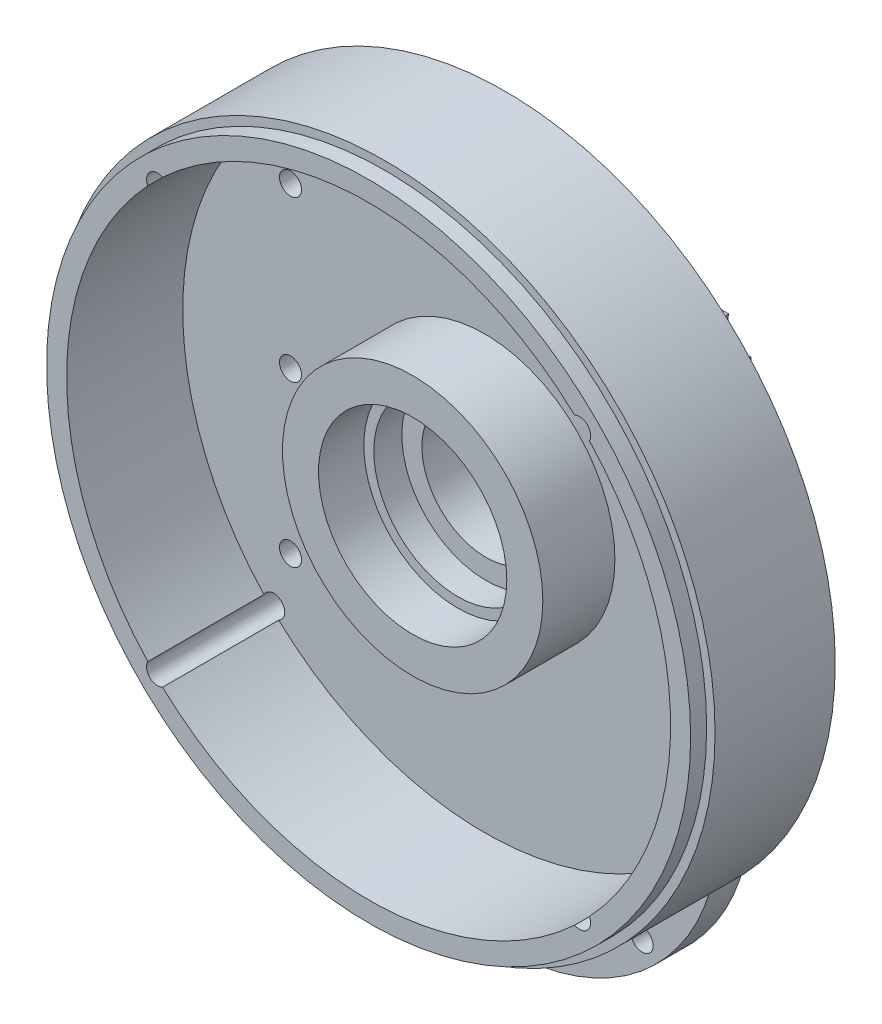
from build123d import *

# Parameters (mm, degrees)
EXTRUS_O1_DEPTH                        = 8
ESBO_O2_R                              = 82.5
EXTRUS_O2_DEPTH                        = 34
ESBO_O3_OUTSIDE_W                      = 217.358
ESBO_O3_OUTSIDE_H                      = 237.858
ESBO_O3_OUTSIDE_R                      = 80.4
CORTE_EXTRUS_O1_DEPTH                  = 4
ESBO_O4_R                              = 75.4
CORTE_EXTRUS_O2_DEPTH                  = 29
ESBO_O5_R                              = 32.5
EXTRUS_O3_DEPTH                        = 18
ESBO_O6_R                              = 23.5
CORTE_EXTRUS_O3_DEPTH                  = 11.3
ESBO_O7_R                              = 21
CORTE_EXTRUS_O4_DEPTH                  = 7
ESBO_O8_R                              = 16
CORTE_EXTRUS_O5_DEPTH                  = 136.752725571
ESBO_O9_R                              = 22.5
EXTRUS_O4_DEPTH                        = 1
ESBO_O10_R                             = 16
CORTE_EXTRUS_O7_DEPTH                  = 9
ESBO_O11_R                             = 13
CORTE_EXTRUS_O8_DEPTH                  = 2
FURO_DE_DI_METRO_5_5_5_5_1_D           = 5.5
FURO_DE_DI_METRO_5_5_5_5_1_CSINK_D     = 6
FURO_DE_DI_METRO_5_5_5_5_1_CSINK_ANGLE = 118
ESBO_O12_R                             = 5
CORTE_EXTRUS_O9_DEPTH                  = 8
FURO_DE_DI_METRO_5_5_5_5_2_D           = 5.5
CIRPATTERN1_COUNT                      = 4
CORTE_EXTRUS_O10_START                 = -2
ESBO_O18_R                             = 22.5
CORTE_EXTRUS_O10_DEPTH                 = 2
FURO_DE_DI_METRO_5_0_5_1_D             = 5
FURO_DE_DI_METRO_5_5_5_5_3_D           = 5.5
FURO_DE_DI_METRO_5_5_5_5_3_DEPTH       = 11
FURO_DE_DI_METRO_5_5_5_5_3_TIP         = 1.652366702


with BuildPart() as part:
    # Esboço1 → Extrusão1 (new body)
    with BuildSketch(Plane.XY):
        with BuildLine():
            Line((-53.5, 53.5), (-53.5, -50.25))
            ThreePointArc((-53.5, -50.25), (0, -103.75), (53.5, -50.25))
            Line((53.5, -50.25), (53.5, 53.5))
            Line((53.5, 53.5), (-53.5, 53.5))
        make_face()
    extrude(amount=EXTRUS_O1_DEPTH)

    # Esboço2 → Extrusão2 (add)
    with BuildSketch(Plane.XY.offset(8)):
        with Locations(Location((0, -0.75, 0), (0, 0, 231.525902072))):
            Circle(ESBO_O2_R)
    extrude(amount=EXTRUS_O2_DEPTH)

    # Esboço3 outside → Corte-extrusão1 (cut)
    with BuildSketch(Plane.XY.offset(42)):
        with Locations((0, -11)):
            Rectangle(ESBO_O3_OUTSIDE_W, ESBO_O3_OUTSIDE_H)
        with Locations((0, -0.75)):
            Circle(ESBO_O3_OUTSIDE_R, mode=Mode.SUBTRACT)
    extrude(amount=-CORTE_EXTRUS_O1_DEPTH, mode=Mode.SUBTRACT)

    # Esboço4 → Corte-extrusão2 (cut)
    with BuildSketch(Plane.XY.offset(42)):
        with Locations((0, -0.75)):
            Circle(ESBO_O4_R)
    extrude(amount=-CORTE_EXTRUS_O2_DEPTH, mode=Mode.SUBTRACT)

    # Esboço5 → Extrusão3 (add)
    with BuildSketch(Plane.XY.offset(13)):
        with Locations((0, -0.75)):
            Circle(ESBO_O5_R)
    extrude(amount=EXTRUS_O3_DEPTH)

    # Esboço6 → Corte-extrusão3 (cut)
    with BuildSketch(Plane.XY.offset(31)):
        with Locations((0, -0.75)):
            Circle(ESBO_O6_R)
    extrude(amount=-CORTE_EXTRUS_O3_DEPTH, mode=Mode.SUBTRACT)

    # Esboço7 → Corte-extrusão4 (cut)
    with BuildSketch(Plane.XY.offset(19.7)):
        with Locations((0, -0.75)):
            Circle(ESBO_O7_R)
    extrude(amount=-CORTE_EXTRUS_O4_DEPTH, mode=Mode.SUBTRACT)

    # Esboço8 → Corte-extrusão5 (cut, through all)
    with BuildSketch(Plane.XY.offset(12.7)):
        with Locations((0, -0.75)):
            Circle(ESBO_O8_R)
    extrude(amount=-CORTE_EXTRUS_O5_DEPTH, mode=Mode.SUBTRACT)

    # Esboço9 → Extrusão4 (add)
    with BuildSketch(Plane(origin=(0, 0, 0), x_dir=(-1, 0, 0), z_dir=(0, 0, -1))):
        with Locations(Location((0, -50.25, 0), (0, 0, 180))):
            Circle(ESBO_O9_R)
    extrude(amount=EXTRUS_O4_DEPTH)

    # Esboço10 → Corte-extrusão7 (cut)
    with BuildSketch(Plane(origin=(0, 0, -1), x_dir=(-1, 0, 0), z_dir=(0, 0, -1))):
        with Locations((0, -50.25)):
            Circle(ESBO_O10_R)
    extrude(amount=-CORTE_EXTRUS_O7_DEPTH, mode=Mode.SUBTRACT)

    # Esboço11 → Corte-extrusão8 (cut)
    with BuildSketch(Plane(origin=(0, 0, 8), x_dir=(-1, 0, 0), z_dir=(0, 0, -1))):
        with Locations((0, -50.25)):
            Circle(ESBO_O11_R)
    extrude(amount=-CORTE_EXTRUS_O8_DEPTH, mode=Mode.SUBTRACT)

    # Furo de diâmetro Ø5.5 (5.5)1 (through all)
    with Locations(Plane(origin=(0, 48.5, 0), x_dir=(-1, 0, 0), z_dir=(0, 0, -1))):
        with Locations((0, 0)):
            furo_de_di_metro_5_5_5_5_1 = CounterSinkHole(FURO_DE_DI_METRO_5_5_5_5_1_D / 2, FURO_DE_DI_METRO_5_5_5_5_1_CSINK_D / 2, counter_sink_angle=FURO_DE_DI_METRO_5_5_5_5_1_CSINK_ANGLE)

    # Esboço12 → Corte-extrusão9 (cut)
    with BuildSketch(Plane(origin=(0, 0, 8), x_dir=(-1, 0, 0), z_dir=(0, 0, -1))):
        with Locations((52.679455198, 51.929455198)):
            Circle(ESBO_O12_R)
    corte_extrus_o9 = extrude(amount=CORTE_EXTRUS_O9_DEPTH, mode=Mode.SUBTRACT)

    # Furo de diâmetro Ø5.5 (5.5)2 (through all)
    with Locations(Plane(origin=(-52.679455198, 51.929455198, 8), x_dir=(-1, 0, 0), z_dir=(0, 0, -1))):
        with Locations((0, 0)):
            furo_de_di_metro_5_5_5_5_2 = Hole(FURO_DE_DI_METRO_5_5_5_5_2_D / 2)

    # CirPattern1: Corte-extrusão9, Furo de diâmetro Ø5.5 (5.5)2 ×4 about axis
    cirpattern1_axis = Axis((0, -0.75, 0), (0, 0, 1))
    add([corte_extrus_o9.rotate(cirpattern1_axis, i * 360 / CIRPATTERN1_COUNT) for i in range(1, CIRPATTERN1_COUNT)], mode=Mode.SUBTRACT)
    add([furo_de_di_metro_5_5_5_5_2.rotate(cirpattern1_axis, i * 360 / CIRPATTERN1_COUNT) for i in range(1, CIRPATTERN1_COUNT)], mode=Mode.SUBTRACT)

    # Esboço-padrão1: Furo de diâmetro Ø5.5 (5.5)1 at 8 more places
    with Locations((-25, 0, 0), (-48.5, -8.5, 0), (-48.5, -48.5, 0), (-48.5, -88.5, 0), (48.5, -88.5, 0), (48.5, -48.5, 0), (48.5, -8.5, 0), (25, 0, 0)):
        add(furo_de_di_metro_5_5_5_5_1, mode=Mode.SUBTRACT)

    # Esboço18 → Corte-extrusão10 (cut)
    with BuildSketch(Plane(origin=(0, 0, 0), x_dir=(-1, 0, 0), z_dir=(0, 0, -1)).offset(CORTE_EXTRUS_O10_START)):
        with BuildLine():
            Line((43.5, -50.25), (43.5, 43.5))
            Line((43.5, 43.5), (-43.5, 43.5))
            Line((-43.5, 43.5), (-43.5, -50.25))
            ThreePointArc((-43.5, -50.25), (0, -93.75), (43.5, -50.25))
        make_face()
        with Locations((0, -50.25)):
            Circle(ESBO_O18_R, mode=Mode.SUBTRACT)
    extrude(amount=CORTE_EXTRUS_O10_DEPTH, mode=Mode.SUBTRACT)

    # Furo de diâmetro Ø5.0 (5)1 (through all)
    with Locations(Plane(origin=(10, 48.5, 0), x_dir=(-1, 0, 0), z_dir=(0, 0, -1))):
        with Locations((0, 0), (0, -146.207876059)):
            Hole(FURO_DE_DI_METRO_5_0_5_1_D / 2)

    # Furo de diâmetro Ø5.5 (5.5)3
    with Locations(Plane(origin=(0, -98.75, 0), x_dir=(-1, 0, 0), z_dir=(0, 0, -1))):
        with Locations((0, 0), (34.294678888, 14.205321112), (-34.294678888, 14.205321112)):
            Hole(FURO_DE_DI_METRO_5_5_5_5_3_D / 2, depth=FURO_DE_DI_METRO_5_5_5_5_3_DEPTH)
            with Locations((0, 0, -(FURO_DE_DI_METRO_5_5_5_5_3_DEPTH + FURO_DE_DI_METRO_5_5_5_5_3_TIP / 2))):  # 118° drill point
                Cone(0, FURO_DE_DI_METRO_5_5_5_5_3_D / 2, FURO_DE_DI_METRO_5_5_5_5_3_TIP, mode=Mode.SUBTRACT)


solid = part.part
